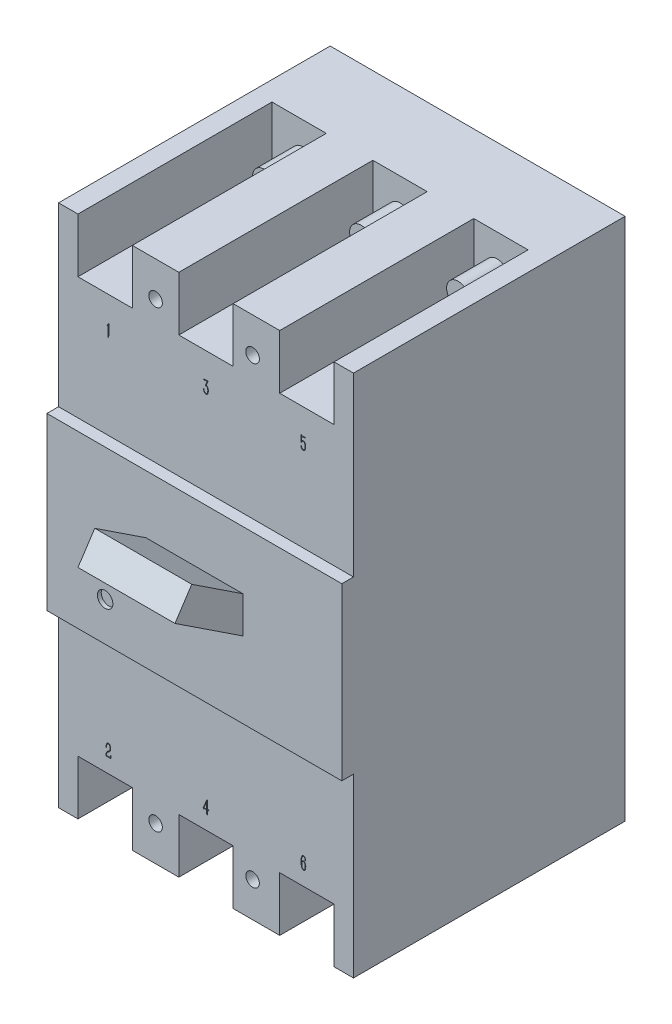
from build123d import *

# Parameters (mm, degrees)
SKETCH_1_W                 = 76
SKETCH_1_H                 = 135
EXTRUDE_1_DEPTH            = 73
SKETCH_2_W                 = 76
SKETCH_2_H                 = 45.5
CUT_EXTRUDE_1_DEPTH        = 3
EXTRUDE_START              = -38
EXTRUDE_2_DEPTH            = 12.5
SKETCH_4_W                 = 14
SKETCH_4_H                 = 14
SKETCH_4_W_2               = 7
CUT_EXTRUDE_2_DEPTH        = 50
MIRROR_3_COPY_1_SKETCH_W   = 14
MIRROR_3_COPY_1_SKETCH_H   = 14
MIRROR_3_COPY_1_SKETCH_W_2 = 7
MIRROR_3_COPY_1_DEPTH      = 50
SKETCH_5_R                 = 3
EXTRUDE_3_DEPTH            = 10
SKETCH_6_R                 = 3
EXTRUDE_4_DEPTH            = 10
MIRROR_5_COPY_1_SKETCH_R   = 3
MIRROR_5_COPY_1_DEPTH      = 10
MIRROR_5_COPY_2_SKETCH_R   = 3
MIRROR_5_COPY_2_DEPTH      = 10
SKETCH_7_R                 = 1.75
CUT_EXTRUDE_3_DEPTH        = 105.404262365
SKETCH_8_R                 = 2
CUT_EXTRUDE_4_DEPTH        = 1
CUT_EXTRUDE_5_DEPTH        = 1


with BuildPart() as part:
    # 草图1 → 凸台-拉伸1 (new body)
    with BuildSketch(Plane.XY):
        Rectangle(SKETCH_1_W, SKETCH_1_H)
    extrude(amount=EXTRUDE_1_DEPTH)

    # 草图2 → 切除-拉伸1 (cut)
    with BuildSketch(Plane.XY.offset(73)):
        with Locations((0, 44.75)):
            Rectangle(SKETCH_2_W, SKETCH_2_H)
    cut_extrude_1 = extrude(amount=-CUT_EXTRUDE_1_DEPTH, mode=Mode.SUBTRACT)

    # 镜向1: 切除-拉伸1 across plane
    add(cut_extrude_1.mirror(Plane.ZX), mode=Mode.SUBTRACT)

    # 草图3 → 凸台-拉伸2 (add, symmetric)
    with BuildSketch(Plane.ZY.offset(38).offset(EXTRUDE_START)):
        Polygon((73, 7.012509971), (86.166983982, 15.696939302), (90.5, 9.127393931), (73, -2.414923846), align=None)
    extrude(amount=EXTRUDE_2_DEPTH, both=True)

    # 草图4 → 切除-拉伸2 (cut)
    with BuildSketch(Plane.XY.offset(70)):
        with Locations((26, 60.5)):
            Rectangle(SKETCH_4_W, SKETCH_4_H)
        with Locations((3.5, 60.5)):
            Rectangle(SKETCH_4_W_2, SKETCH_4_H)
    cut_extrude_2 = extrude(amount=-CUT_EXTRUDE_2_DEPTH, mode=Mode.SUBTRACT)

    # 镜向2: 切除-拉伸2 across plane
    add(cut_extrude_2.mirror(Plane(origin=(0, 0, 0), x_dir=(0, 0, 1), z_dir=(1, 0, 0))), mode=Mode.SUBTRACT)

    # 镜向3: 切除-拉伸2 across plane
    add(cut_extrude_2.mirror(Plane.ZX), mode=Mode.SUBTRACT)

    # 镜向3 copy 1 sketch → 镜向3 copy 1 (cut)
    with BuildSketch(Plane(origin=(0, 0, 70), x_dir=(-1, 0, 0), z_dir=(0, 0, 1))):
        with Locations((26, 60.5)):
            Rectangle(MIRROR_3_COPY_1_SKETCH_W, MIRROR_3_COPY_1_SKETCH_H)
        with Locations((3.5, 60.5)):
            Rectangle(MIRROR_3_COPY_1_SKETCH_W_2, MIRROR_3_COPY_1_SKETCH_H)
    extrude(amount=-MIRROR_3_COPY_1_DEPTH, mode=Mode.SUBTRACT)

    # 草图5 → 凸台-拉伸3 (add)
    with BuildSketch(Plane.XY.offset(20)):
        with Locations((25, 58.5)):
            Circle(SKETCH_5_R)
    extrude_3 = extrude(amount=EXTRUDE_3_DEPTH)

    # 草图6 → 凸台-拉伸4 (add)
    with BuildSketch(Plane.XY.offset(20)):
        with Locations((0, 58.5)):
            Circle(SKETCH_6_R)
    extrude_4 = extrude(amount=EXTRUDE_4_DEPTH)

    # 镜向4: 凸台-拉伸3, 凸台-拉伸4 across plane
    add(extrude_3.mirror(Plane(origin=(0, 0, 0), x_dir=(0, 0, 1), z_dir=(1, 0, 0))))
    add(extrude_4.mirror(Plane(origin=(0, 0, 0), x_dir=(0, 0, 1), z_dir=(1, 0, 0))))

    # 镜向5: 凸台-拉伸3, 凸台-拉伸4 across plane
    add(extrude_3.mirror(Plane.ZX))
    add(extrude_4.mirror(Plane.ZX))

    # 镜向5 copy 1 sketch → 镜向5 copy 1 (add)
    with BuildSketch(Plane(origin=(0, 0, 20), x_dir=(-1, 0, 0), z_dir=(0, 0, 1))):
        with Locations((25, 58.5)):
            Circle(MIRROR_5_COPY_1_SKETCH_R)
    extrude(amount=MIRROR_5_COPY_1_DEPTH)

    # 镜向5 copy 2 sketch → 镜向5 copy 2 (add)
    with BuildSketch(Plane(origin=(0, 0, 20), x_dir=(-1, 0, 0), z_dir=(0, 0, 1))):
        with Locations((0, 58.5)):
            Circle(MIRROR_5_COPY_2_SKETCH_R)
    extrude(amount=MIRROR_5_COPY_2_DEPTH)

    # 草图7 → 切除-拉伸3 (cut, through all)
    with BuildSketch(Plane.XY.offset(70)):
        with Locations((12, 58.5)):
            Circle(SKETCH_7_R)
        with Locations((-13, 58.5)):
            Circle(SKETCH_7_R)
    cut_extrude_3 = extrude(amount=-CUT_EXTRUDE_3_DEPTH, mode=Mode.SUBTRACT)

    # 镜向6: 切除-拉伸3 across plane
    add(cut_extrude_3.mirror(Plane.ZX), mode=Mode.SUBTRACT)

    # 草图8 → 切除-拉伸4 (cut)
    with BuildSketch(Plane.XY.offset(73)):
        with Locations((-23, -12)):
            Circle(SKETCH_8_R)
    extrude(amount=-CUT_EXTRUDE_4_DEPTH, mode=Mode.SUBTRACT)

    # 草图9 → 切除-拉伸5 (cut)
    # profile 1 of 6: a face of its own
    with BuildSketch(Plane.XY.offset(70)):
        with BuildLine():
            Line((-25.108779033, 47.034306414), (-25.053590454, 47.034306414))
            Line((-25.053590454, 47.034306414), (-25.058810995, 44.360643512))
            add(Edge.make_bspline(
                [(-25.058810995, 44.360643512), (-25.059405713, 44.336531223), (-25.060546017, 44.290298592), (-25.060638562, 44.224151689), (-25.062813974, 44.164261802), (-25.062987246, 44.110543188), (-25.064604847, 44.063066024), (-25.066475447, 44.021820374), (-25.06665319, 43.986728926), (-25.069961947, 43.931806279), (-25.073904769, 43.856291737), (-25.083682765, 43.778513041), (-25.091466784, 43.723092466), (-25.099379882, 43.697864051), (-25.109404965, 43.677902503), (-25.119409977, 43.680230387), (-25.123694865, 43.68122736)],
                knots=[0, 0, 0, 0, 1.45038606, 2.780953852, 3.977268029, 5.053718292, 6.010937745, 6.833690271, 7.536464333, 8.120251454, 10.142880859, 12.069479857, 12.873132744, 13.440417135, 13.76034519, 14, 14, 14, 14], degree=3))
            add(Edge.make_bspline(
                [(-25.123694865, 43.68122736), (-25.124685394, 43.681977123), (-25.128925101, 43.68518629), (-25.139035628, 43.691978917), (-25.15104902, 43.710186957), (-25.156307731, 43.726522015), (-25.159492862, 43.736415939)],
                knots=[0, 0, 0, 0, 0.221265066, 0.947068446, 2.150880552, 4, 4, 4, 4], degree=3))
            Line((-25.159492862, 43.736415939), (-25.184103985, 43.8020456))
            Line((-25.184103985, 43.8020456), (-25.240038355, 43.98327296))
            add(Edge.make_bspline(
                [(-25.240038355, 43.98327296), (-25.246771647, 44.000324587), (-25.258500693, 44.030027641), (-25.270332713, 44.069106135), (-25.279308882, 44.094059404), (-25.281694675, 44.114285114), (-25.270202298, 44.133256883), (-25.261738556, 44.162467624), (-25.248715118, 44.199753211), (-25.236416533, 44.243760308), (-25.225553981, 44.291309282), (-25.215768716, 44.342684453), (-25.210223126, 44.400567186), (-25.207502798, 44.455833044), (-25.205415108, 44.509042479), (-25.205035807, 44.560268342), (-25.203989644, 44.620921331), (-25.204153074, 44.664677216), (-25.204240358, 44.688046026)],
                knots=[0, 0, 0, 0, 1.220359697, 2.125803599, 2.712350858, 2.994193817, 3.439826662, 4.12562012, 5.031064022, 6.063176816, 7.167225426, 8.277459231, 9.542238136, 11.034069985, 11.961482632, 13.08703073, 14.444263491, 16, 16, 16, 16], degree=3))
            Line((-25.204240358, 44.688046026), (-25.199765608, 46.661410612))
            Line((-25.199765608, 46.661410612), (-25.461538462, 46.434689964))
            Line((-25.461538462, 46.434689964), (-25.481674835, 46.520455998))
            add(Edge.make_bspline(
                [(-25.481674835, 46.520455998), (-25.460396396, 46.542443117), (-25.420509085, 46.583658879), (-25.367201956, 46.643002168), (-25.323358708, 46.694502744), (-25.27769304, 46.754709329), (-25.226565114, 46.82963605), (-25.188808755, 46.89119403), (-25.169188153, 46.923183465)],
                knots=[0, 0, 0, 0, 1.077185482, 2.019228619, 2.808185376, 3.45765616, 4.678836699, 6, 6, 6, 6], degree=3))
            Line((-25.169188153, 46.923183465), (-25.108779033, 47.034306414))
        make_face()
    # profile 2 of 6: a face of its own
    with BuildSketch(Plane.XY.offset(70)):
        with BuildLine():
            add(Edge.make_bspline(
                [(-0.111122949, 45.810462391), (-0.099951315, 45.833589435), (-0.078430623, 45.878140663), (-0.047040673, 45.942493606), (-0.017756712, 46.001577682), (0.007289912, 46.056404139), (0.03064475, 46.105764243), (0.051445258, 46.15018641), (0.069418298, 46.189685164), (0.088340113, 46.233537238), (0.107964925, 46.279285126), (0.126963392, 46.324094015), (0.1407793, 46.356102037), (0.147922153, 46.373034953), (0.150649904, 46.379501385)],
                knots=[0, 0, 0, 0, 1.475873638, 2.843077615, 4.114458223, 5.26483622, 6.306479236, 7.252326145, 8.083448402, 8.799989154, 9.996708352, 10.943956596, 11.596712522, 12, 12, 12, 12], degree=3))
            Line((0.150649904, 46.379501385), (0.311740891, 46.807585766))
            add(Edge.make_bspline(
                [(0.311740891, 46.807585766), (0.276704734, 46.804157075), (0.200257567, 46.796675841), (0.10269751, 46.790735725), (0.021579819, 46.786409905), (-0.034080787, 46.781745782), (-0.082820595, 46.777386359), (-0.112867585, 46.774069735), (-0.126784573, 46.772533561)],
                knots=[0, 0, 0, 0, 1.440114021, 3.142257811, 3.998086789, 4.76330671, 5.427195687, 6, 6, 6, 6], degree=3))
            Line((-0.126784573, 46.772533561), (-0.277434477, 46.747176646))
            add(Edge.make_bspline(
                [(-0.277434477, 46.747176646), (-0.284165922, 46.745761471), (-0.302531143, 46.741900485), (-0.336494107, 46.731357329), (-0.385407047, 46.718391681), (-0.422636463, 46.707729147), (-0.443746005, 46.701683358)],
                knots=[0, 0, 0, 0, 0.478461291, 1.305373098, 2.472113022, 4, 4, 4, 4], degree=3))
            Line((-0.443746005, 46.701683358), (-0.493714042, 46.681546985))
            Line((-0.493714042, 46.681546985), (-0.619752823, 46.867994886))
            add(Edge.make_bspline(
                [(-0.619752823, 46.867994886), (-0.625075021, 46.875294714), (-0.634160581, 46.8877563), (-0.641703214, 46.905091621), (-0.647302011, 46.917134887), (-0.642283975, 46.929262471), (-0.622441187, 46.927443918), (-0.60745958, 46.91680722), (-0.58832388, 46.90657335), (-0.566307828, 46.905134019), (-0.539616577, 46.903567608), (-0.520054229, 46.906607977), (-0.509375666, 46.908267633)],
                knots=[0, 0, 0, 0, 1.323589942, 2.259509366, 2.829398404, 3.190947808, 3.965341466, 5.19662492, 6.050472624, 7.088782, 8.410843841, 10, 10, 10, 10], degree=3))
            Line((-0.509375666, 46.908267633), (-0.348284679, 46.913488174))
            Line((-0.348284679, 46.913488174), (0.286383976, 46.988813126))
            Line((0.286383976, 46.988813126), (0.336352014, 47.034306414))
            Line((0.336352014, 47.034306414), (0.37662476, 47.07457916))
            add(Edge.make_bspline(
                [(0.37662476, 47.07457916), (0.377873736, 47.073092428), (0.382993845, 47.066997649), (0.394016521, 47.052494818), (0.413616383, 47.029194078), (0.428434751, 47.009776485), (0.43703388, 46.998508417)],
                knots=[0, 0, 0, 0, 0.23984028, 0.983211964, 2.249351781, 4, 4, 4, 4], degree=3))
            Line((0.43703388, 46.998508417), (0.533240997, 46.877690177))
            add(Edge.make_bspline(
                [(0.533240997, 46.877690177), (0.539701457, 46.869302134), (0.550437717, 46.855362537), (0.558402743, 46.833069109), (0.550241028, 46.817964796), (0.538839605, 46.805017661), (0.520357836, 46.789467159), (0.505714634, 46.77864613), (0.497443, 46.772533561)],
                knots=[0, 0, 0, 0, 1.419029252, 2.358201718, 2.827787952, 3.596253847, 4.642174893, 6, 6, 6, 6], degree=3))
            Line((0.497443, 46.772533561), (0.442254421, 46.727040273))
            add(Edge.make_bspline(
                [(0.442254421, 46.727040273), (0.426125887, 46.686506975), (0.395524258, 46.609600733), (0.351433372, 46.500149867), (0.311088411, 46.402832313), (0.27566274, 46.31679816), (0.243123763, 46.243025268), (0.216260914, 46.180427165), (0.192075608, 46.13020579), (0.177282608, 46.10080722), (0.170786277, 46.087896868)],
                knots=[0, 0, 0, 0, 1.507300768, 2.859891598, 4.076963614, 5.147345159, 6.074452096, 6.862861548, 7.500626815, 8, 8, 8, 8], degree=3))
            Line((0.170786277, 46.087896868), (0.019390582, 45.8007671))
            add(Edge.make_bspline(
                [(0.019390582, 45.8007671), (0.03728604, 45.802195946), (0.071559, 45.804932439), (0.12386377, 45.81015627), (0.180852824, 45.802970936), (0.230837152, 45.782980329), (0.273365092, 45.75831345), (0.307442737, 45.733676087), (0.339998789, 45.70165441), (0.373195953, 45.664010589), (0.406470665, 45.619080736), (0.437058598, 45.564661457), (0.468900245, 45.502519508), (0.508721893, 45.407816173), (0.55175088, 45.281101178), (0.577894593, 45.121946436), (0.590811588, 44.962489754), (0.592707896, 44.856371069), (0.593650117, 44.803643725)],
                knots=[0, 0, 0, 0, 0.660541429, 1.265053373, 1.928435853, 2.750244091, 3.225390118, 3.735570922, 4.291687282, 4.900607759, 5.580848831, 6.342918567, 7.193367346, 8.147740655, 10.119512469, 12.097611575, 14.061014616, 16, 16, 16, 16], degree=3))
            add(Edge.make_bspline(
                [(0.593650117, 44.803643725), (0.591659755, 44.762363845), (0.587878706, 44.683945329), (0.578740806, 44.573133948), (0.565104394, 44.475918021), (0.545245292, 44.366315493), (0.510222312, 44.245226268), (0.466955864, 44.133510275), (0.425875025, 44.053025261), (0.39125301, 43.999656143), (0.353332028, 43.951910647), (0.312580986, 43.910128162), (0.270191495, 43.875791728), (0.229050556, 43.846261269), (0.187420102, 43.8253901), (0.133525752, 43.807954302), (0.067665569, 43.795935699), (0.015210766, 43.793527826), (-0.010441082, 43.792350309)],
                knots=[0, 0, 0, 0, 1.512752116, 2.8737433, 4.067977017, 5.104892351, 6.948544146, 8.672095895, 9.482011449, 10.251829035, 10.996496654, 11.710742831, 12.38300564, 12.991319199, 13.561044299, 14.079002633, 15.060579187, 16, 16, 16, 16], degree=3))
            add(Edge.make_bspline(
                [(-0.010441082, 43.792350309), (-0.032321017, 43.791977356), (-0.074415503, 43.791259836), (-0.135472449, 43.796230338), (-0.191081903, 43.807606906), (-0.243234336, 43.823082986), (-0.29207678, 43.847556614), (-0.33873076, 43.8825171), (-0.38569636, 43.925566915), (-0.43072697, 43.978396905), (-0.471939597, 44.038922579), (-0.507974834, 44.105872242), (-0.537915153, 44.178298085), (-0.567679609, 44.281370017), (-0.592907508, 44.413168693), (-0.597401927, 44.519872451), (-0.59961645, 44.572448327)],
                knots=[0, 0, 0, 0, 0.828828519, 1.594571005, 2.314948186, 2.97625877, 3.650192192, 4.371738268, 5.178272596, 6.059897072, 6.995131469, 7.947518938, 8.935744196, 9.957858231, 12.008325587, 14, 14, 14, 14], degree=3))
            Line((-0.59961645, 44.572448327), (-0.604836991, 44.768591519))
            Line((-0.604836991, 44.768591519), (-0.549648413, 44.768591519))
            add(Edge.make_bspline(
                [(-0.549648413, 44.768591519), (-0.545428215, 44.739505045), (-0.537346162, 44.683801866), (-0.525589888, 44.603436334), (-0.513413575, 44.530177708), (-0.499691213, 44.443483121), (-0.476837056, 44.34613445), (-0.438334771, 44.241361869), (-0.386120279, 44.152835647), (-0.324814037, 44.079883965), (-0.253112734, 44.026931873), (-0.176355302, 43.993530791), (-0.098125623, 43.977760235), (-0.046293398, 43.977956297), (-0.020882165, 43.978052418)],
                knots=[0, 0, 0, 0, 0.994021113, 1.903638599, 2.746793397, 3.505624798, 4.871908371, 6.122639036, 7.264652637, 8.331625701, 9.323760524, 10.250011688, 11.142051883, 12, 12, 12, 12], degree=3))
            add(Edge.make_bspline(
                [(-0.020882165, 43.978052418), (-0.00043921, 43.979815268), (0.039600034, 43.983267958), (0.097661285, 43.99641271), (0.151356262, 44.018841707), (0.201550394, 44.04752351), (0.24673012, 44.084925568), (0.287392117, 44.128997405), (0.321827628, 44.181353691), (0.360420135, 44.261508139), (0.397926129, 44.372011634), (0.42614641, 44.512370412), (0.444509809, 44.655540092), (0.453136834, 44.797993223), (0.454312311, 44.938334289), (0.442772424, 45.030183148), (0.43703388, 45.07585766)],
                knots=[0, 0, 0, 0, 0.647840119, 1.268849254, 1.871153999, 2.479976942, 3.088343857, 3.716462885, 4.367721208, 5.059616847, 6.52246665, 8.039623249, 9.575767262, 11.078710543, 12.547304005, 14, 14, 14, 14], degree=3))
            add(Edge.make_bspline(
                [(0.43703388, 45.07585766), (0.429009699, 45.125088053), (0.413147738, 45.222405208), (0.376455962, 45.339214311), (0.340324795, 45.426438384), (0.308089521, 45.484958794), (0.271552246, 45.537231368), (0.23016481, 45.581073147), (0.188209559, 45.617050157), (0.146097677, 45.641056719), (0.104509972, 45.653409977), (0.07786152, 45.650694047), (0.06488387, 45.649371404)],
                knots=[0, 0, 0, 0, 2.019199264, 3.991492233, 4.943861116, 5.841091039, 6.693606335, 7.520378909, 8.278781735, 8.923571305, 9.475785111, 10, 10, 10, 10], degree=3))
            Line((0.06488387, 45.649371404), (-0.015661624, 45.639676113))
            Line((-0.015661624, 45.639676113), (-0.050713829, 45.574046452))
            add(Edge.make_bspline(
                [(-0.050713829, 45.574046452), (-0.055392355, 45.565867362), (-0.063548173, 45.5516092), (-0.074693011, 45.532763121), (-0.083594255, 45.521724539), (-0.0903505, 45.51220847), (-0.100117216, 45.515409688), (-0.106399184, 45.526348658), (-0.116441489, 45.542452355), (-0.122973916, 45.556283081), (-0.126784573, 45.564351161)],
                knots=[0, 0, 0, 0, 1.659028505, 2.892093886, 3.763458346, 4.288089223, 4.647361994, 5.327919393, 6.441255868, 8, 8, 8, 8], degree=3))
            Line((-0.126784573, 45.564351161), (-0.207330066, 45.720221607))
            add(Edge.make_bspline(
                [(-0.207330066, 45.720221607), (-0.213152051, 45.729180034), (-0.223301431, 45.744797127), (-0.2189014, 45.762599317), (-0.217025357, 45.770189644)],
                knots=[0, 0, 0, 0, 1.147259222, 2, 2, 2, 2], degree=3))
            Line((-0.217025357, 45.770189644), (-0.17675261, 45.785851268))
            Line((-0.17675261, 45.785851268), (-0.111122949, 45.810462391))
        make_face()
    # profile 3 of 6: a face of its own
    with BuildSketch(Plane.XY.offset(70)):
        with BuildLine():
            add(Edge.make_bspline(
                [(24.674728319, 46.853079054), (24.686454852, 46.854315631), (24.706772607, 46.856458162), (24.726707927, 46.86089729), (24.735137439, 46.862774345)],
                knots=[0, 0, 0, 0, 1.154313806, 2, 2, 2, 2], degree=3))
            Line((24.735137439, 46.862774345), (24.841039847, 46.867994886))
            Line((24.841039847, 46.867994886), (25.037183039, 46.89782655))
            Line((25.037183039, 46.89782655), (25.203494566, 46.917962924))
            add(Edge.make_bspline(
                [(25.203494566, 46.917962924), (25.219031206, 46.92047472), (25.251683843, 46.925753645), (25.282698499, 46.937278625), (25.298955892, 46.943319838)],
                knots=[0, 0, 0, 0, 0.951631555, 2, 2, 2, 2], degree=3))
            Line((25.298955892, 46.943319838), (25.374280844, 46.973897294))
            add(Edge.make_bspline(
                [(25.374280844, 46.973897294), (25.382031453, 46.976773555), (25.395629695, 46.981819881), (25.412978964, 46.989755389), (25.425471878, 46.994829095), (25.432203283, 46.997515879), (25.434689964, 46.998508417)],
                knots=[0, 0, 0, 0, 1.520021181, 2.666837392, 3.507509911, 4, 4, 4, 4], degree=3))
            Line((25.434689964, 46.998508417), (25.480183252, 47.029085873))
            Line((25.480183252, 47.029085873), (25.626358406, 46.882910718))
            add(Edge.make_bspline(
                [(25.626358406, 46.882910718), (25.631836363, 46.875592833), (25.641426583, 46.862781464), (25.644977625, 46.840840175), (25.640294908, 46.824896631), (25.634953388, 46.810864827), (25.619862799, 46.802411493), (25.608065596, 46.802382554), (25.601001492, 46.802365225)],
                knots=[0, 0, 0, 0, 1.452844315, 2.54348448, 3.406058373, 4.120848162, 4.874773518, 6, 6, 6, 6], degree=3))
            Line((25.601001492, 46.802365225), (24.664287236, 46.671851694))
            Line((24.664287236, 46.671851694), (24.649371404, 45.649371404))
            add(Edge.make_bspline(
                [(24.649371404, 45.649371404), (24.668433247, 45.672548872), (24.703595338, 45.715302777), (24.755854345, 45.776541341), (24.816586024, 45.828564156), (24.878931101, 45.862154614), (24.937388012, 45.885981939), (24.989181798, 45.898111208), (25.046397544, 45.905740422), (25.086377303, 45.906350451), (25.107287449, 45.906669508)],
                knots=[0, 0, 0, 0, 1.30943776, 2.415431215, 3.508265892, 4.775479805, 5.486396256, 6.257089544, 7.088425914, 8, 8, 8, 8], degree=3))
            add(Edge.make_bspline(
                [(25.107287449, 45.906669508), (25.127966425, 45.905329537), (25.167053725, 45.902796731), (25.221552708, 45.893164311), (25.268874818, 45.879600798), (25.322878538, 45.851803695), (25.385976508, 45.803673952), (25.445458331, 45.744842623), (25.491755779, 45.687836143), (25.525889487, 45.638853076), (25.554268225, 45.582820205), (25.581342541, 45.522502055), (25.605462114, 45.456329404), (25.62537591, 45.383723666), (25.641657229, 45.304731749), (25.65838528, 45.188413079), (25.673173452, 45.030970482), (25.675246155, 44.901632104), (25.676326444, 44.83422118)],
                knots=[0, 0, 0, 0, 0.737858689, 1.39469691, 1.969129469, 2.484137971, 3.548991738, 4.782985237, 5.456749125, 6.164369648, 6.905359031, 7.690566505, 8.520047268, 9.411980184, 10.370982938, 11.392008999, 13.598323608, 16, 16, 16, 16], degree=3))
            add(Edge.make_bspline(
                [(25.676326444, 44.83422118), (25.675120315, 44.80414015), (25.672787176, 44.745951333), (25.668804577, 44.661598278), (25.661909966, 44.583284286), (25.651296748, 44.489110778), (25.634852877, 44.381232336), (25.605976557, 44.261586384), (25.566205554, 44.151338515), (25.513079709, 44.052061618), (25.452968857, 43.965347572), (25.388634123, 43.896048271), (25.322231184, 43.845650844), (25.251485214, 43.813904085), (25.174248969, 43.799722227), (25.120758876, 43.79782952), (25.092371617, 43.796825059)],
                knots=[0, 0, 0, 0, 0.953497838, 1.844448518, 2.674189816, 3.442807412, 4.845957472, 6.127295929, 7.335424679, 8.547012004, 9.682888764, 10.668703604, 11.530079681, 12.305522429, 13.100738679, 14, 14, 14, 14], degree=3))
            add(Edge.make_bspline(
                [(25.092371617, 43.796825059), (25.058310257, 43.796236308), (24.995136346, 43.795144347), (24.904336973, 43.806001227), (24.82197017, 43.835808698), (24.743636026, 43.881328515), (24.670438454, 43.945454086), (24.607398598, 44.023998451), (24.557095833, 44.108903944), (24.520659185, 44.197503968), (24.49836203, 44.293158909), (24.479345993, 44.397308655), (24.466599732, 44.507519245), (24.467639516, 44.581866497), (24.468144044, 44.617941615)],
                knots=[0, 0, 0, 0, 1.038316962, 1.925775792, 2.769505923, 3.689817589, 4.672983852, 5.718137725, 6.747565775, 7.672204827, 8.626195073, 9.735182009, 10.901054531, 12, 12, 12, 12], degree=3))
            Line((24.468144044, 44.617941615), (24.473364586, 44.758896228))
            Line((24.473364586, 44.758896228), (24.528553164, 44.758896228))
            add(Edge.make_bspline(
                [(24.528553164, 44.758896228), (24.530850648, 44.73078902), (24.535393885, 44.675207472), (24.54554979, 44.591913184), (24.562062876, 44.507379032), (24.582184677, 44.421851972), (24.608650749, 44.341167369), (24.636837969, 44.266706141), (24.677147207, 44.198939277), (24.726140239, 44.131159375), (24.789211724, 44.068596197), (24.852054597, 44.025248686), (24.909540749, 44.000513156), (24.958662121, 43.986947363), (25.013617858, 43.97999511), (25.052081729, 43.978720344), (25.072235244, 43.978052418)],
                knots=[0, 0, 0, 0, 1.11825376, 2.211328589, 3.324923754, 4.532299777, 5.691974021, 6.691431964, 7.680579644, 8.808308283, 10.000254076, 11.186807161, 11.80939407, 12.474247533, 13.200567339, 14, 14, 14, 14], degree=3))
            add(Edge.make_bspline(
                [(25.072235244, 43.978052418), (25.095915856, 43.978149553), (25.143697662, 43.978345548), (25.203738676, 43.992595379), (25.251009997, 44.015064168), (25.287647925, 44.041407242), (25.325919423, 44.074883356), (25.362876655, 44.117327484), (25.398893295, 44.164524764), (25.430641963, 44.216268124), (25.456025446, 44.271983402), (25.482786692, 44.352210268), (25.507650005, 44.460885822), (25.530445489, 44.600794455), (25.542316658, 44.753723966), (25.541180782, 44.859811044), (25.540592372, 44.914766674)],
                knots=[0, 0, 0, 0, 0.849390509, 1.713866746, 2.18933602, 2.722107664, 3.329685584, 4.012931591, 4.740083059, 5.461671267, 6.189151886, 6.934940173, 8.497098365, 10.188936476, 12.025778447, 14, 14, 14, 14], degree=3))
            add(Edge.make_bspline(
                [(25.540592372, 44.914766674), (25.538919475, 44.946860946), (25.535724266, 45.008160572), (25.526190784, 45.095614491), (25.516421601, 45.174352142), (25.499545809, 45.266416244), (25.472172705, 45.371708387), (25.432982051, 45.469390278), (25.395056687, 45.5399153), (25.363975643, 45.586702873), (25.32843648, 45.626669556), (25.28970016, 45.660478714), (25.247652438, 45.687431906), (25.203367638, 45.70798623), (25.156197672, 45.721018287), (25.12377225, 45.723951121), (25.107287449, 45.725442148)],
                knots=[0, 0, 0, 0, 1.343436322, 2.565945237, 3.677305729, 4.659990038, 6.477828082, 8.216935171, 9.044830502, 9.823221578, 10.559528994, 11.274319052, 11.966299338, 12.640726254, 13.308957145, 14, 14, 14, 14], degree=3))
            add(Edge.make_bspline(
                [(25.107287449, 45.725442148), (25.089352343, 45.724893209), (25.054488154, 45.723826121), (25.003710577, 45.714811462), (24.956671109, 45.699035092), (24.900354108, 45.671356195), (24.838648236, 45.630521421), (24.778676793, 45.574585654), (24.731708577, 45.517916248), (24.710197452, 45.477464717), (24.700085233, 45.458448753)],
                knots=[0, 0, 0, 0, 0.840347904, 1.633558669, 2.40744423, 3.157989381, 4.570423979, 5.856859538, 6.992525654, 8, 8, 8, 8], degree=3))
            Line((24.700085233, 45.458448753), (24.664287236, 45.387598551))
            Line((24.664287236, 45.387598551), (24.654591945, 45.322714681))
            add(Edge.make_bspline(
                [(24.654591945, 45.322714681), (24.654018827, 45.313802638), (24.653012678, 45.298156949), (24.649620583, 45.277314507), (24.647560934, 45.26446721), (24.645816865, 45.252834572), (24.634310243, 45.254246791), (24.623147342, 45.264707586), (24.603220403, 45.280779878), (24.588115336, 45.29452601), (24.579266993, 45.302578308)],
                knots=[0, 0, 0, 0, 1.417361355, 2.488272572, 3.242975776, 3.665551287, 3.979432497, 4.77388376, 6.110184861, 8, 8, 8, 8], degree=3))
            Line((24.579266993, 45.302578308), (24.473364586, 45.387598551))
            add(Edge.make_bspline(
                [(24.473364586, 45.387598551), (24.464287613, 45.395854264), (24.450197408, 45.408669626), (24.434717169, 45.432942631), (24.446235377, 45.458583701), (24.456471287, 45.474053968), (24.462923503, 45.483805668)],
                knots=[0, 0, 0, 0, 1.303116375, 2.022830373, 2.753688992, 4, 4, 4, 4], degree=3))
            Line((24.462923503, 45.483805668), (24.518857873, 45.55913062))
            Line((24.518857873, 45.55913062), (24.528553164, 46.097592159))
            Line((24.528553164, 46.097592159), (24.533773706, 46.485403793))
            add(Edge.make_bspline(
                [(24.533773706, 46.485403793), (24.533774288, 46.499822442), (24.533775543, 46.530897116), (24.533764567, 46.580616346), (24.533814134, 46.636551667), (24.533608074, 46.695713846), (24.534321425, 46.75266383), (24.53229745, 46.801119108), (24.531377064, 46.838464529), (24.52938469, 46.859299376), (24.528553164, 46.867994886)],
                knots=[0, 0, 0, 0, 0.904131945, 1.948560225, 3.117696361, 4.41154035, 5.658618894, 6.687930963, 7.452402571, 8, 8, 8, 8], degree=3))
            Line((24.528553164, 46.867994886), (24.508416791, 47.023865331))
            Line((24.508416791, 47.023865331), (24.55913062, 47.044001705))
            add(Edge.make_bspline(
                [(24.55913062, 47.044001705), (24.566517202, 47.025347291), (24.578936506, 46.993983012), (24.596376237, 46.952094926), (24.61836237, 46.920605528), (24.635192337, 46.902819327), (24.644150863, 46.893351801)],
                knots=[0, 0, 0, 0, 1.37928148, 2.31903137, 3.105226912, 4, 4, 4, 4], degree=3))
            Line((24.644150863, 46.893351801), (24.674728319, 46.853079054))
        make_face()
    # profile 4 of 6: a face of its own
    with BuildSketch(Plane.XY.offset(70)):
        with BuildLine():
            Line((-25.647240571, -47.939500611), (-25.723311315, -47.939500611))
            add(Edge.make_bspline(
                [(-25.723311315, -47.939500611), (-25.724878719, -47.915391356), (-25.72786685, -47.86942897), (-25.730950194, -47.803789696), (-25.732252305, -47.744853652), (-25.733556722, -47.67300371), (-25.731544983, -47.582391849), (-25.726143295, -47.5094075), (-25.723311315, -47.471143484)],
                knots=[0, 0, 0, 0, 0.927540379, 1.768282303, 2.522502339, 3.190652681, 4.527123766, 6, 6, 6, 6], degree=3))
            add(Edge.make_bspline(
                [(-25.723311315, -47.471143484), (-25.721351407, -47.442777206), (-25.717561171, -47.387920076), (-25.707558167, -47.30885757), (-25.695981661, -47.235593195), (-25.680931105, -47.166682641), (-25.660595325, -47.09924678), (-25.631645143, -47.031417926), (-25.595538811, -46.960872861), (-25.552880139, -46.890080916), (-25.506073502, -46.823283033), (-25.453534994, -46.768925785), (-25.398549173, -46.727494587), (-25.340045566, -46.702836711), (-25.283873627, -46.68750303), (-25.232649422, -46.675441456), (-25.186617842, -46.667012045), (-25.157535111, -46.666112445), (-25.143831238, -46.665688551)],
                knots=[0, 0, 0, 0, 1.238521709, 2.395159043, 3.470603583, 4.46912877, 5.466066804, 6.534123646, 7.677244524, 8.916145015, 10.13365226, 11.221244199, 12.198275335, 13.109907183, 13.966820176, 14.733954848, 15.403435577, 16, 16, 16, 16], degree=3))
            add(Edge.make_bspline(
                [(-25.143831238, -46.665688551), (-25.126367043, -46.666976233), (-25.091858333, -46.669520653), (-25.041096977, -46.681309647), (-24.992071926, -46.698307617), (-24.929367231, -46.728587638), (-24.856044183, -46.776062535), (-24.793665805, -46.838404939), (-24.750501738, -46.895471256), (-24.720096885, -46.944039103), (-24.693153388, -46.998271859), (-24.659317285, -47.077073897), (-24.623920016, -47.18164492), (-24.598393314, -47.313718846), (-24.582026223, -47.450871739), (-24.574537756, -47.5910833), (-24.573145357, -47.729912917), (-24.58129709, -47.820455341), (-24.585233326, -47.864175659)],
                knots=[0, 0, 0, 0, 0.570779476, 1.127842599, 1.694919432, 2.261066821, 3.397481896, 4.527710891, 5.118384485, 5.730727279, 6.394748858, 7.092559246, 8.529363642, 9.986910621, 11.474321506, 13.03467297, 14.568129345, 16, 16, 16, 16], degree=3))
            add(Edge.make_bspline(
                [(-24.585233326, -47.864175659), (-24.593212701, -47.909147907), (-24.609290504, -47.999763396), (-24.64392019, -48.108863194), (-24.676216298, -48.191807157), (-24.70321754, -48.247388062), (-24.7320681, -48.29659265), (-24.773785836, -48.35478195), (-24.837494269, -48.420833311), (-24.896530527, -48.465128118), (-24.927551673, -48.488403232)],
                knots=[0, 0, 0, 0, 1.490916612, 3.004077927, 3.729534125, 4.397912905, 5.020560084, 5.590839424, 6.734084393, 8, 8, 8, 8], degree=3))
            Line((-24.927551673, -48.488403232), (-25.174408694, -48.644273678))
            add(Edge.make_bspline(
                [(-25.174408694, -48.644273678), (-25.205865698, -48.665629442), (-25.265514181, -48.706124047), (-25.345161374, -48.772270081), (-25.412011874, -48.841966166), (-25.462540969, -48.919029414), (-25.50178588, -48.998355213), (-25.536634113, -49.07800607), (-25.562942757, -49.165799647), (-25.581654487, -49.244491501), (-25.594415268, -49.31058082), (-25.600807399, -49.356672921), (-25.60600014, -49.397409683), (-25.606658753, -49.422866502), (-25.606967824, -49.434812778)],
                knots=[0, 0, 0, 0, 1.453572249, 2.75625039, 3.953730064, 5.132566341, 6.263730064, 7.337486329, 8.453238547, 9.76321854, 10.430854957, 11.026567013, 11.543191201, 12, 12, 12, 12], degree=3))
            Line((-25.606967824, -49.434812778), (-25.617408907, -49.645871802))
            Line((-25.617408907, -49.645871802), (-24.716492649, -49.616040138))
            add(Edge.make_bspline(
                [(-24.716492649, -49.616040138), (-24.704932371, -49.615393774), (-24.68462793, -49.614258501), (-24.665114115, -49.592985114), (-24.660770566, -49.567010293), (-24.653063208, -49.535062012), (-24.647333315, -49.489267), (-24.642913103, -49.454440647), (-24.640421905, -49.434812778)],
                knots=[0, 0, 0, 0, 0.925905201, 1.626257371, 2.181371879, 3.087088273, 4.358305093, 6, 6, 6, 6], degree=3))
            Line((-24.640421905, -49.434812778), (-24.620285532, -48.996287315))
            Line((-24.620285532, -48.996287315), (-24.550181121, -48.996287315))
            Line((-24.550181121, -48.996287315), (-24.524824206, -49.660787635))
            add(Edge.make_bspline(
                [(-24.524824206, -49.660787635), (-24.523976511, -49.673706245), (-24.522493891, -49.696300908), (-24.521772171, -49.726190381), (-24.521751744, -49.747002904), (-24.522066513, -49.763806904), (-24.527478703, -49.778498959), (-24.532507716, -49.795546578), (-24.552125423, -49.805177679), (-24.580324486, -49.808259208), (-24.623180791, -49.812623484), (-24.656816639, -49.812344351), (-24.676219902, -49.81218333)],
                knots=[0, 0, 0, 0, 1.385018147, 2.4223982, 3.193529914, 3.619812046, 4.200562765, 4.878496499, 5.402948042, 6.404258339, 7.925751149, 10, 10, 10, 10], degree=3))
            Line((-24.676219902, -49.81218333), (-25.677818027, -49.837540245))
            add(Edge.make_bspline(
                [(-25.677818027, -49.837540245), (-25.689993466, -49.837575864), (-25.713992156, -49.837646071), (-25.73858515, -49.813782097), (-25.748908782, -49.784567953), (-25.754075718, -49.750206257), (-25.757536656, -49.704619665), (-25.759199077, -49.626213526), (-25.755644874, -49.514653639), (-25.747639134, -49.422599214), (-25.743447688, -49.374403658)],
                knots=[0, 0, 0, 0, 0.556373901, 1.096654043, 1.476064089, 2.012759395, 2.73145082, 3.635924119, 5.715166189, 8, 8, 8, 8], degree=3))
            add(Edge.make_bspline(
                [(-25.743447688, -49.374403658), (-25.739728128, -49.346271977), (-25.732562965, -49.292080594), (-25.717994509, -49.214074864), (-25.702462174, -49.141668085), (-25.685605491, -49.074904063), (-25.666996541, -49.014134525), (-25.646684925, -48.959429042), (-25.625628804, -48.909906558), (-25.59400142, -48.85388367), (-25.553805475, -48.792816835), (-25.508084796, -48.726972086), (-25.464064686, -48.671118057), (-25.406528256, -48.609669622), (-25.328634947, -48.542598044), (-25.263199611, -48.493486571), (-25.229597273, -48.468266859)],
                knots=[0, 0, 0, 0, 1.103491021, 2.125706759, 3.085324024, 3.98349739, 4.803138144, 5.555704107, 6.252741852, 6.89323317, 8.054555834, 9.09539633, 10.010480884, 10.817709087, 12.365830683, 14, 14, 14, 14], degree=3))
            Line((-25.229597273, -48.468266859), (-25.023012998, -48.337007537))
            add(Edge.make_bspline(
                [(-25.023012998, -48.337007537), (-25.006473717, -48.326011217), (-24.974735039, -48.304909415), (-24.930897184, -48.271313635), (-24.893523768, -48.236455623), (-24.861316577, -48.198839276), (-24.832161023, -48.155311828), (-24.808216713, -48.101055546), (-24.782903235, -48.037146869), (-24.753389125, -47.937716911), (-24.722957945, -47.806478107), (-24.711292328, -47.644327396), (-24.717524206, -47.480073801), (-24.73657623, -47.371053787), (-24.746324313, -47.315273038)],
                knots=[0, 0, 0, 0, 0.635613896, 1.219735276, 1.765761318, 2.268061313, 2.802129131, 3.435697723, 4.161225462, 5.001884758, 6.75303811, 8.46119913, 10.189351173, 12, 12, 12, 12], degree=3))
            add(Edge.make_bspline(
                [(-24.746324313, -47.315273038), (-24.753669659, -47.286836038), (-24.767995522, -47.231374444), (-24.795110262, -47.151479855), (-24.830208633, -47.078713785), (-24.867776149, -47.0107391), (-24.914841146, -46.951237766), (-24.977532432, -46.908503972), (-25.051593679, -46.879937417), (-25.105767615, -46.874907011), (-25.134135947, -46.872272825)],
                knots=[0, 0, 0, 0, 1.101106684, 2.147523679, 3.156537618, 4.125318695, 5.058520457, 5.968677808, 6.93629249, 8, 8, 8, 8], degree=3))
            add(Edge.make_bspline(
                [(-25.134135947, -46.872272825), (-25.149068343, -46.872119949), (-25.178852054, -46.871815026), (-25.223213576, -46.878542327), (-25.266361268, -46.892647645), (-25.323039684, -46.918212751), (-25.388532734, -46.965833626), (-25.457469096, -47.0376845), (-25.514330632, -47.125415982), (-25.55810966, -47.227080768), (-25.59102823, -47.342904675), (-25.617751665, -47.472711808), (-25.635299042, -47.618148279), (-25.640201479, -47.71994288), (-25.642765821, -47.773189084)],
                knots=[0, 0, 0, 0, 0.469335518, 0.936122588, 1.403629858, 1.893624907, 2.887406355, 3.927357629, 5.011993806, 6.157121359, 7.396943717, 8.794309501, 10.323183677, 12, 12, 12, 12], degree=3))
            Line((-25.642765821, -47.773189084), (-25.647240571, -47.939500611))
        make_face()
    # profile 5 of 6: a face of its own
    with BuildSketch(Plane.XY.offset(70)):
        with BuildLine():
            Line((0.180481568, -48.90082599), (-0.529512039, -48.941098736))
            Line((-0.529512039, -48.941098736), (-0.579480077, -49.016423688))
            add(Edge.make_bspline(
                [(-0.579480077, -49.016423688), (-0.582740774, -49.024317187), (-0.587668698, -49.036246711), (-0.605888487, -49.048549511), (-0.619556949, -49.030902192), (-0.626015872, -49.019393486), (-0.630193906, -49.011948939)],
                knots=[0, 0, 0, 0, 1.282902353, 1.938863145, 2.666728425, 4, 4, 4, 4], degree=3))
            Line((-0.630193906, -49.011948939), (-0.725655231, -48.820280496))
            add(Edge.make_bspline(
                [(-0.725655231, -48.820280496), (-0.729739021, -48.808962144), (-0.736473147, -48.790298299), (-0.741375841, -48.765246881), (-0.739981876, -48.747578535), (-0.736746424, -48.738452007), (-0.735350522, -48.734514462)],
                knots=[0, 0, 0, 0, 1.63130738, 2.690008936, 3.434818089, 4, 4, 4, 4], degree=3))
            Line((-0.735350522, -48.734514462), (-0.695077775, -48.724819171))
            Line((-0.695077775, -48.724819171), (-0.639889197, -48.694241715))
            Line((-0.639889197, -48.694241715), (0.211059024, -46.640331636))
            Line((0.211059024, -46.640331636), (0.321436182, -46.640331636))
            Line((0.321436182, -46.640331636), (0.321436182, -48.714378088))
            add(Edge.make_bspline(
                [(0.321436182, -48.714378088), (0.331807727, -48.714456721), (0.3494433, -48.714590426), (0.365525721, -48.707573176), (0.372150011, -48.704682798)],
                knots=[0, 0, 0, 0, 1.176207474, 2, 2, 2, 2], degree=3))
            Line((0.372150011, -48.704682798), (0.447474963, -48.674105342))
            add(Edge.make_bspline(
                [(0.447474963, -48.674105342), (0.457212608, -48.670471001), (0.47456965, -48.663992903), (0.496919088, -48.654263986), (0.512740349, -48.64677316), (0.520112304, -48.641115693), (0.522799915, -48.639053136)],
                knots=[0, 0, 0, 0, 1.495147538, 2.665053038, 3.513315187, 4, 4, 4, 4], degree=3))
            Line((0.522799915, -48.639053136), (0.55785212, -48.609221472))
            Line((0.55785212, -48.609221472), (0.698806733, -48.754650835))
            add(Edge.make_bspline(
                [(0.698806733, -48.754650835), (0.70598748, -48.76329236), (0.717742071, -48.777438185), (0.722872452, -48.801377158), (0.717979879, -48.817566371), (0.708833846, -48.8292249), (0.692891374, -48.834111851), (0.681156494, -48.834792551), (0.67419561, -48.835196328)],
                knots=[0, 0, 0, 0, 1.690587597, 2.767423091, 3.557953073, 4.202677464, 4.933866242, 6, 6, 6, 6], degree=3))
            Line((0.67419561, -48.835196328), (0.321436182, -48.875469075))
            Line((0.321436182, -48.875469075), (0.321436182, -49.777131125))
            add(Edge.make_bspline(
                [(0.321436182, -49.777131125), (0.321418229, -49.779866045), (0.32135781, -49.789070104), (0.322516246, -49.80844582), (0.322985986, -49.839275878), (0.32359046, -49.877586099), (0.324625684, -49.916027507), (0.324291216, -49.947163017), (0.322273056, -49.966797384), (0.317526379, -49.979415722), (0.308234911, -49.981675123), (0.303465775, -49.979488117), (0.301299808, -49.978494858)],
                knots=[0, 0, 0, 0, 0.375701713, 1.264380521, 2.665139726, 4.612257271, 6.525225464, 7.960129458, 8.858599367, 9.286556546, 9.675980055, 10, 10, 10, 10], degree=3))
            add(Edge.make_bspline(
                [(0.301299808, -49.978494858), (0.297088952, -49.97599198), (0.284395175, -49.968446966), (0.273270015, -49.944098383), (0.259902411, -49.918825991), (0.253893039, -49.900527757), (0.251331771, -49.892728824)],
                knots=[0, 0, 0, 0, 0.572299195, 1.725216547, 3.030459198, 4, 4, 4, 4], degree=3))
            Line((0.251331771, -49.892728824), (0.205838483, -49.801742248))
            Line((0.205838483, -49.801742248), (0.180481568, -49.731637837))
            add(Edge.make_bspline(
                [(0.180481568, -49.731637837), (0.1766255, -49.723236857), (0.169647869, -49.708035119), (0.162004304, -49.687080545), (0.155179779, -49.671610474), (0.151380745, -49.653205806), (0.155837126, -49.624454439), (0.165658732, -49.584190786), (0.177453962, -49.541147894), (0.182995804, -49.501816312), (0.185270896, -49.467909303), (0.185556313, -49.446002951), (0.18570211, -49.434812778)],
                knots=[0, 0, 0, 0, 0.908031708, 1.643101311, 2.192199313, 2.565975908, 3.473020803, 5.002279505, 6.661670863, 7.846934984, 8.900174221, 10, 10, 10, 10], degree=3))
            Line((0.18570211, -49.434812778), (0.180481568, -48.90082599))
        make_face()
        Polygon((0.18570211, -48.734514462), (0.18570211, -47.063195476), (-0.524291498, -48.770312459), align=None, mode=Mode.SUBTRACT)
    # profile 6 of 6: a face of its own
    with BuildSketch(Plane.XY.offset(70)):
        with BuildLine():
            Line((25.650969529, -47.597182265), (25.580865118, -47.597182265))
            add(Edge.make_bspline(
                [(25.580865118, -47.597182265), (25.576073541, -47.567142223), (25.566593146, -47.507706381), (25.55786138, -47.416882718), (25.547212564, -47.322508392), (25.528979888, -47.222651909), (25.500292964, -47.118835267), (25.45994246, -47.036302382), (25.421770846, -46.974460514), (25.38922907, -46.933105166), (25.351895551, -46.898463795), (25.311992315, -46.869300644), (25.269021775, -46.846753544), (25.223971117, -46.830483971), (25.176159824, -46.823205117), (25.127496303, -46.823663627), (25.080114655, -46.829181917), (25.036103375, -46.840657431), (24.996419071, -46.856191994), (24.959582033, -46.876762023), (24.925780708, -46.906507788), (24.890523768, -46.943784296), (24.855155513, -46.99237479), (24.818135066, -47.049767124), (24.782255535, -47.116802419), (24.750600228, -47.193110748), (24.722332441, -47.277625813), (24.689504005, -47.402523762), (24.659063363, -47.570226971), (24.640807081, -47.741806053), (24.632175187, -47.876562194), (24.627891224, -47.966827842), (24.624378626, -48.045127242), (24.624128978, -48.093379168), (24.62401449, -48.11550743)],
                knots=[0, 0, 0, 0, 1.172618578, 2.320089015, 3.517365984, 4.833421129, 6.231766425, 7.655217032, 8.357323983, 9.032478261, 9.676711985, 10.315215253, 10.932648665, 11.54199308, 12.153444918, 12.786093219, 13.413857257, 13.988112725, 14.53457488, 15.054145165, 15.605211832, 16.262994999, 17.029841423, 17.917944275, 18.895673466, 19.956732694, 21.09950916, 22.329492637, 24.933332206, 27.662278065, 28.97833321, 30.139613505, 31.146829503, 32, 32, 32, 32], degree=3))
            Line((24.62401449, -48.11550743), (24.61953974, -48.311650622))
            add(Edge.make_bspline(
                [(24.61953974, -48.311650622), (24.631989159, -48.276522174), (24.654491646, -48.213027047), (24.689041812, -48.125423823), (24.728163583, -48.051140275), (24.773769659, -47.982450701), (24.832787273, -47.919053602), (24.89307699, -47.872735097), (24.949767601, -47.84071943), (25.000110777, -47.822371164), (25.056793716, -47.809696595), (25.096782161, -47.805804999), (25.117728532, -47.803766539)],
                knots=[0, 0, 0, 0, 1.463710204, 2.645675197, 3.693667506, 4.755032446, 5.874045908, 7.078730407, 7.725382873, 8.423483439, 9.174203962, 10, 10, 10, 10], degree=3))
            add(Edge.make_bspline(
                [(25.117728532, -47.803766539), (25.147989781, -47.804923694), (25.205538326, -47.807124282), (25.288387332, -47.83189305), (25.365838582, -47.875356432), (25.425499038, -47.928500357), (25.473660853, -47.980947159), (25.509134961, -48.028973292), (25.543751404, -48.083297635), (25.588246768, -48.164699527), (25.636227445, -48.275713618), (25.670896224, -48.394339291), (25.688904769, -48.494848397), (25.700647423, -48.575863889), (25.706865832, -48.662327169), (25.710489267, -48.78320517), (25.708713381, -48.93407634), (25.700486188, -49.05398935), (25.696462817, -49.112630805)],
                knots=[0, 0, 0, 0, 0.909148716, 1.728949998, 2.576991438, 3.564625719, 4.121218537, 4.72026629, 5.360049571, 6.060456872, 7.512703724, 8.993852322, 9.770776208, 10.587253518, 11.458483217, 12.380006039, 14.229702395, 16, 16, 16, 16], degree=3))
            add(Edge.make_bspline(
                [(25.696462817, -49.112630805), (25.69176277, -49.143008247), (25.682014977, -49.206010387), (25.661360213, -49.303197099), (25.636023145, -49.406428156), (25.606914623, -49.511918377), (25.573210781, -49.612081318), (25.528620972, -49.697439152), (25.474693979, -49.764450849), (25.412384484, -49.810649779), (25.350847812, -49.841092904), (25.295812117, -49.864660437), (25.247907529, -49.881668586), (25.21726319, -49.885697897), (25.203494566, -49.887508282)],
                knots=[0, 0, 0, 0, 1.110217054, 2.302565578, 3.587623031, 4.949459538, 6.256081064, 7.397105523, 8.411240029, 9.334418742, 10.173869837, 10.886090718, 11.499516107, 12, 12, 12, 12], degree=3))
            add(Edge.make_bspline(
                [(25.203494566, -49.887508282), (25.17836845, -49.889614684), (25.128272868, -49.893814356), (25.065002565, -49.882321159), (25.01426442, -49.864608363), (24.973147531, -49.843440224), (24.927453385, -49.817796859), (24.879842972, -49.784310886), (24.831469506, -49.745361481), (24.78818375, -49.697241075), (24.748296044, -49.643521169), (24.702306969, -49.562233203), (24.653938994, -49.454375719), (24.609064842, -49.34238997), (24.580178229, -49.243300709), (24.560592312, -49.154550007), (24.542070758, -49.051533955), (24.526070236, -48.93924269), (24.511953604, -48.828290194), (24.500153566, -48.72880394), (24.490173167, -48.646080134), (24.481092739, -48.558156015), (24.474758129, -48.460417353), (24.472710466, -48.345212579), (24.474671112, -48.223873827), (24.477229855, -48.139866598), (24.478585127, -48.095371057)],
                knots=[0, 0, 0, 0, 0.848219995, 1.691151707, 2.144998995, 2.659153853, 3.249319417, 3.912736756, 4.621867519, 5.340468245, 6.090710837, 6.87657341, 8.487178015, 10.078339935, 10.944022033, 11.968008362, 13.14490399, 14.476453821, 15.796264219, 16.920399402, 17.85823784, 18.608902694, 19.903936842, 21.162934464, 22.497310667, 24, 24, 24, 24], degree=3))
            add(Edge.make_bspline(
                [(24.478585127, -48.095371057), (24.479482512, -48.059818205), (24.481170913, -47.992926666), (24.484992072, -47.898956517), (24.488939213, -47.817842968), (24.497384898, -47.724791162), (24.511299459, -47.610776106), (24.533240417, -47.471253486), (24.558982682, -47.331288497), (24.587045801, -47.218741351), (24.614049915, -47.1326023), (24.639431888, -47.066711237), (24.671333409, -46.999239802), (24.705990254, -46.92979396), (24.745567255, -46.863820747), (24.789149016, -46.804498187), (24.836189958, -46.75441218), (24.886544602, -46.712012555), (24.943383332, -46.679980085), (25.006814205, -46.657344298), (25.077762231, -46.645617032), (25.127136496, -46.645574347), (25.152780737, -46.645552177)],
                knots=[0, 0, 0, 0, 1.211628523, 2.279639787, 3.204225299, 3.977932759, 5.462339825, 7.116605252, 8.789327199, 10.30942825, 11.064792467, 11.863814246, 12.712679163, 13.606614715, 14.50718602, 15.330439464, 16.109367713, 16.843542067, 17.564206182, 18.319665359, 19.127259812, 20, 20, 20, 20], degree=3))
            add(Edge.make_bspline(
                [(25.152780737, -46.645552177), (25.178771934, -46.647703818), (25.22788808, -46.65176982), (25.29558797, -46.670204295), (25.353742094, -46.694682433), (25.399780139, -46.729380937), (25.435909468, -46.767644227), (25.469295038, -46.802399829), (25.495555589, -46.837618037), (25.518395988, -46.872164178), (25.537284941, -46.910520112), (25.556205232, -46.953894813), (25.573706135, -47.004939731), (25.590718816, -47.060763408), (25.606599507, -47.116971978), (25.62012492, -47.169169018), (25.630595761, -47.215179931), (25.641194044, -47.270682199), (25.64997857, -47.343587566), (25.650620301, -47.403491628), (25.650969529, -47.436091278)],
                knots=[0, 0, 0, 0, 1.358046768, 2.566331314, 3.646368544, 4.629682629, 5.546946845, 6.391627168, 7.141431054, 7.835891544, 8.549473584, 9.368770778, 10.304200405, 11.362836174, 12.414134618, 13.351720444, 14.176238426, 14.875889185, 16.299866179, 18, 18, 18, 18], degree=3))
            Line((25.650969529, -47.436091278), (25.650969529, -47.597182265))
        make_face()
        with BuildLine():
            add(Edge.make_bspline(
                [(24.68442361, -48.84041687), (24.685931507, -48.885214992), (24.689026201, -48.977155254), (24.707830684, -49.116596258), (24.74052568, -49.258065574), (24.779596324, -49.373989809), (24.818354288, -49.462593298), (24.853172517, -49.522431358), (24.890921608, -49.576954877), (24.93409389, -49.623774445), (24.981570173, -49.663534086), (25.036433257, -49.688573342), (25.095830676, -49.703327657), (25.136784384, -49.701834132), (25.158001278, -49.701060381)],
                knots=[0, 0, 0, 0, 1.4886747, 3.055242853, 4.666194597, 6.306608966, 7.112592917, 7.87485258, 8.603662743, 9.310999056, 9.986965693, 10.644668568, 11.297843225, 12, 12, 12, 12], degree=3))
            add(Edge.make_bspline(
                [(25.158001278, -49.701060381), (25.176298879, -49.699325974), (25.212973113, -49.69584967), (25.2662304, -49.676704258), (25.317434513, -49.648062488), (25.365488667, -49.608941824), (25.409143479, -49.562729465), (25.447997562, -49.511511156), (25.479397579, -49.455198073), (25.512215394, -49.372389625), (25.542489582, -49.258876392), (25.559141571, -49.112492744), (25.569392979, -48.959351914), (25.577298121, -48.801541846), (25.575507784, -48.63797609), (25.555879465, -48.528756049), (25.545812913, -48.472741609)],
                knots=[0, 0, 0, 0, 0.542441635, 1.087226227, 1.660703064, 2.273516638, 2.914006631, 3.539772715, 4.172601069, 4.816509057, 6.173746714, 7.636628278, 9.17189136, 10.71932084, 12.317475397, 14, 14, 14, 14], degree=3))
            add(Edge.make_bspline(
                [(25.545812913, -48.472741609), (25.532147784, -48.426801541), (25.504995352, -48.335519227), (25.453171171, -48.229329316), (25.405087339, -48.153490461), (25.369544769, -48.104028102), (25.329847257, -48.065908849), (25.290358509, -48.035170326), (25.249090006, -48.013704988), (25.208157629, -47.99703455), (25.165470095, -47.989829537), (25.137135119, -47.98958905), (25.122949073, -47.989468649)],
                knots=[0, 0, 0, 0, 2.076888393, 4.126750173, 5.096135134, 5.973977047, 6.759453719, 7.47553224, 8.136547057, 8.771446398, 9.384918551, 10, 10, 10, 10], degree=3))
            add(Edge.make_bspline(
                [(25.122949073, -47.989468649), (25.105665113, -47.992142632), (25.070862144, -47.997526963), (25.020719654, -48.015899114), (24.972657589, -48.042587623), (24.914426914, -48.088804068), (24.850677966, -48.153468412), (24.801394326, -48.228084313), (24.772374635, -48.293771119), (24.751585359, -48.349961756), (24.733189391, -48.414877386), (24.716099991, -48.487216005), (24.702078561, -48.566876915), (24.691581813, -48.652738387), (24.685829732, -48.744628213), (24.684901774, -48.807843101), (24.68442361, -48.84041687)],
                knots=[0, 0, 0, 0, 0.703513377, 1.416593983, 2.138698186, 2.910269809, 4.405335412, 5.780974721, 6.484987373, 7.296510348, 8.193863016, 9.202460595, 10.29132512, 11.452082192, 12.687092747, 14, 14, 14, 14], degree=3))
        make_face(mode=Mode.SUBTRACT)
    extrude(amount=-CUT_EXTRUDE_5_DEPTH, mode=Mode.SUBTRACT)


solid = part.part
